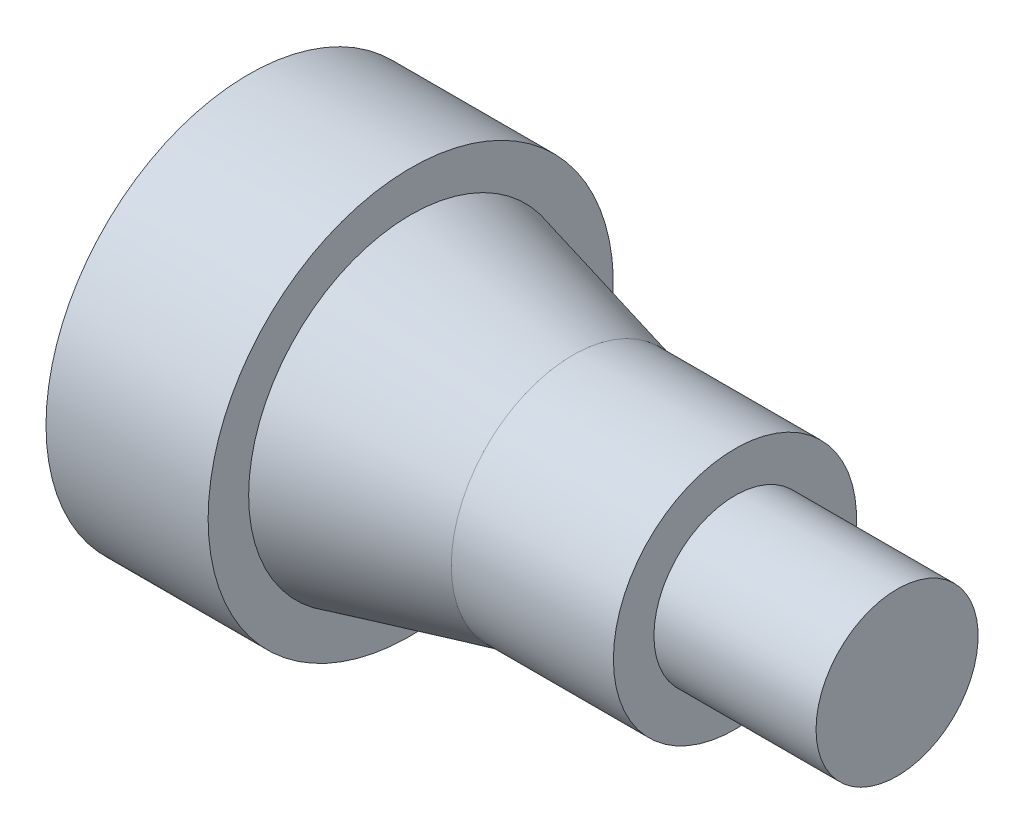
from build123d import *


with BuildPart() as part:
    # 스케치1 → 회전1 (revolve)
    with BuildSketch(Plane(origin=(0, 0, 0), x_dir=(1, 0, 0), z_dir=(0, 1, 0)), mode=Mode.PRIVATE) as revolve_1_sk:
        Polygon((-40, 0), (-40, 25), (-20, 25), (-20, 20), (0, 15), (20, 15), (20, 10), (40, 10), (40, 0), align=None)
    revolve(revolve_1_sk.sketch.rotate(Axis((-49.758874749, 0, 0), (1, 0, 0)), 180), axis=Axis((-49.758874749, 0, 0), (1, 0, 0)))


solid = part.part
